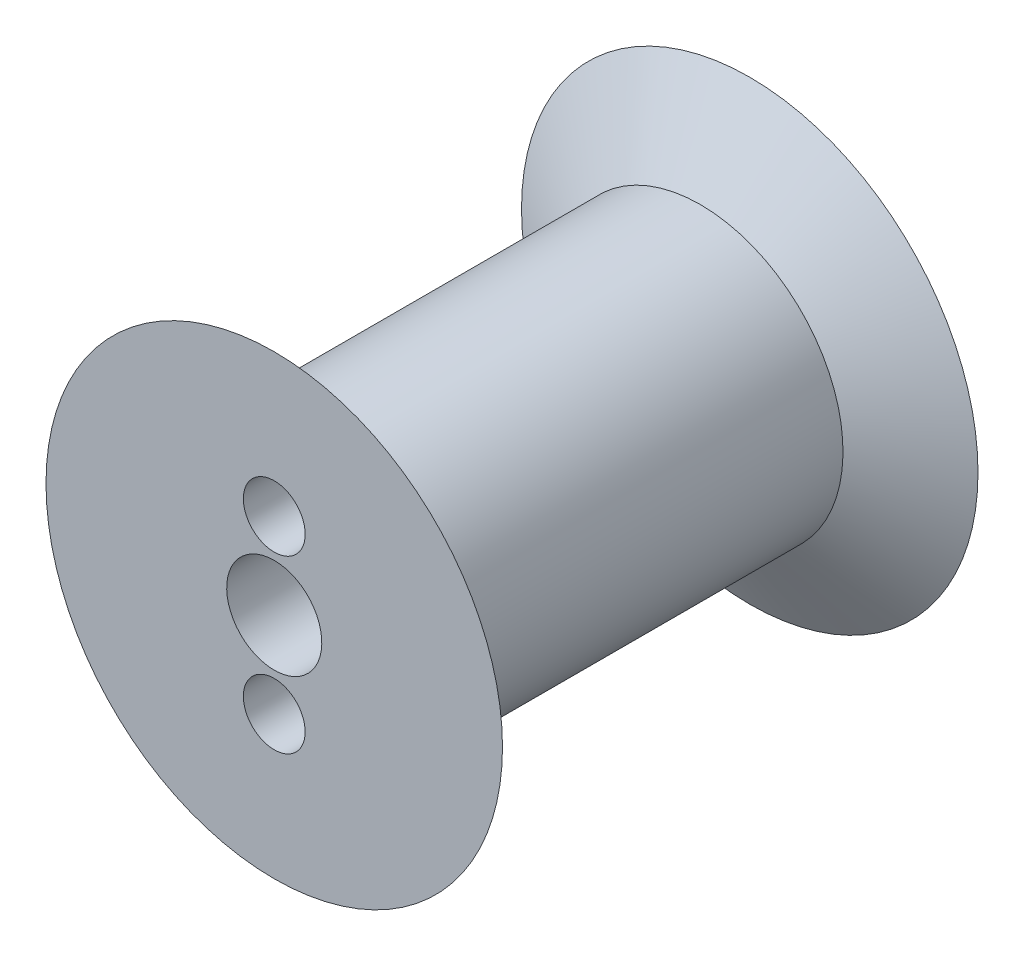
from build123d import *

# Parameters (mm, degrees)
CBORE_FOR_M3_SHCS1_D           = 3.4
CBORE_FOR_M3_SHCS1_CBORE_D     = 6.5
CBORE_FOR_M3_SHCS1_CBORE_DEPTH = 40


with BuildPart() as part:
    # Sketch2 → Revolve1 (revolve)
    with BuildSketch(Plane(origin=(0, 0, 0), x_dir=(-1, 0, 0), z_dir=(0, -1, 0)), mode=Mode.PRIVATE) as revolve1_sk:
        Polygon((5, 0), (5, -50), (24, -50), (15, -44.803847577), (15, -5.196152423), (24, 0), align=None)
    revolve(revolve1_sk.sketch.rotate(Axis((0, 0, 0), (0, 0, 1)), 270), axis=Axis((0, 0, 0), (0, 0, 1)))

    # CBORE for M3 SHCS1 (through all)
    with Locations(Plane.XY.offset(50)):
        with Locations((0, -9), (0, 9)):
            CounterBoreHole(CBORE_FOR_M3_SHCS1_D / 2, CBORE_FOR_M3_SHCS1_CBORE_D / 2, CBORE_FOR_M3_SHCS1_CBORE_DEPTH)


solid = part.part
